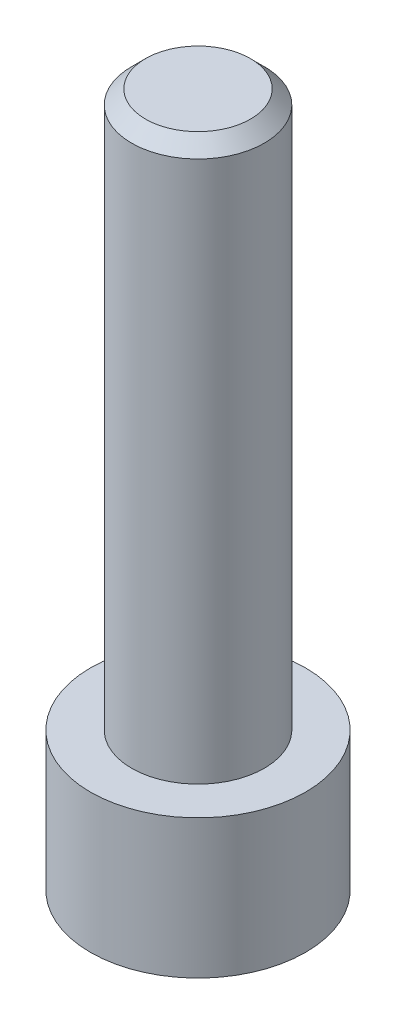
from build123d import *

# Parameters (mm, degrees)
SKETCH1_R           = 3.875
BOSS_EXTRUDE1_DEPTH = 25
SKETCH2_OUTSIDE_W   = 15.21
SKETCH2_OUTSIDE_H   = 15.21
SKETCH2_OUTSIDE_R   = 2.39
CUT_EXTRUDE1_DEPTH  = 20
CHAMFER1_SIZE       = 0.5
CUT_EXTRUDE2_DEPTH  = 3.36


with BuildPart() as part:
    # Sketch1 → Boss-Extrude1 (new body)
    with BuildSketch(Plane(origin=(0, 0, 0), x_dir=(1, 0, 0), z_dir=(0, 1, 0))):
        with Locations(Location((0, 0, 0), (0, 0, 270))):
            Circle(SKETCH1_R)
    extrude(amount=BOSS_EXTRUDE1_DEPTH)

    # Sketch2 outside → Cut-Extrude1 (cut)
    with BuildSketch(Plane(origin=(0, 25, 0), x_dir=(1, 0, 0), z_dir=(0, 1, 0))):
        Rectangle(SKETCH2_OUTSIDE_W, SKETCH2_OUTSIDE_H)
        with Locations(Location((0, 0, 0), (0, 0, 270))):
            Circle(SKETCH2_OUTSIDE_R, mode=Mode.SUBTRACT)
    extrude(amount=-CUT_EXTRUDE1_DEPTH, mode=Mode.SUBTRACT)

    # Chamfer1
    chamfer1_edges = [part.edges().sort_by_distance(p)[0] for p in [
        (0, 25, -2.39),
    ]]
    chamfer(chamfer1_edges, length=CHAMFER1_SIZE)

    # Sketch8 → Cut-Extrude2 (cut)
    with BuildSketch(Plane.XZ):
        Polygon((2.644264233, 0), (1.322132116, 2.29), (-1.322132116, 2.29), (-2.644264233, 0), (-1.322132116, -2.29), (1.322132116, -2.29), align=None)
    extrude(amount=-CUT_EXTRUDE2_DEPTH, mode=Mode.SUBTRACT)


solid = part.part
